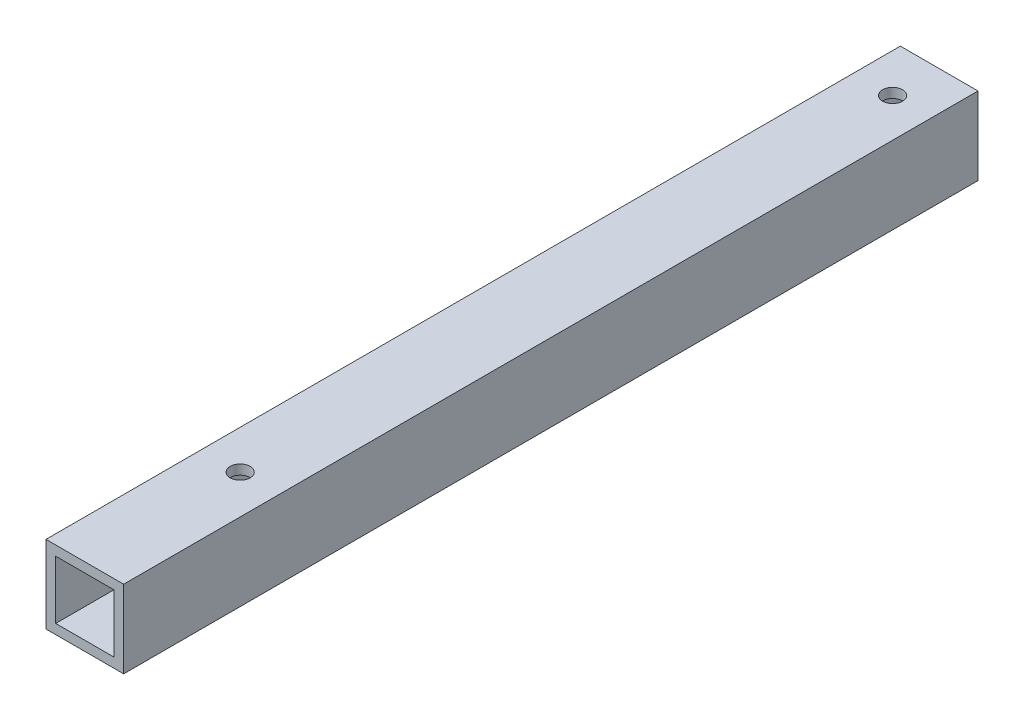
from build123d import *

# Parameters (mm, degrees)
SKETCH2_W           = 25.4
SKETCH2_H           = 25.4
BOSS_EXTRUDE1_DEPTH = 279.4
SKETCH4_W           = 19.05
SKETCH4_H           = 19.05
CUT_EXTRUDE1_DEPTH  = 280.9766776
SKETCH5_R           = 3.2639
CUT_EXTRUDE2_DEPTH  = 281.839473721
SKETCH6_R           = 3.2639
CUT_EXTRUDE3_DEPTH  = 281.839473721


with BuildPart() as part:
    # Sketch2 → Boss-Extrude1 (new body)
    with BuildSketch(Plane.XY):
        Rectangle(SKETCH2_W, SKETCH2_H)
    extrude(amount=BOSS_EXTRUDE1_DEPTH)

    # Sketch4 → Cut-Extrude1 (cut, through all)
    with BuildSketch(Plane.XY):
        Rectangle(SKETCH4_W, SKETCH4_H)
    extrude(amount=CUT_EXTRUDE1_DEPTH, mode=Mode.SUBTRACT)

    # Sketch5 → Cut-Extrude2 (cut, through all)
    with BuildSketch(Plane(origin=(0, 12.7, 0), x_dir=(1, 0, 0), z_dir=(0, 1, 0))):
        with Locations(Location((0, -15.24, 0), (0, 0, 270))):
            Circle(SKETCH5_R)
    extrude(amount=-CUT_EXTRUDE2_DEPTH, mode=Mode.SUBTRACT)

    # Sketch6 → Cut-Extrude3 (cut, through all)
    with BuildSketch(Plane(origin=(0, 12.7, 0), x_dir=(1, 0, 0), z_dir=(0, 1, 0))):
        with Locations(Location((0, -228.6, 0), (0, 0, 270))):
            Circle(SKETCH6_R)
    extrude(amount=-CUT_EXTRUDE3_DEPTH, mode=Mode.SUBTRACT)


solid = part.part
